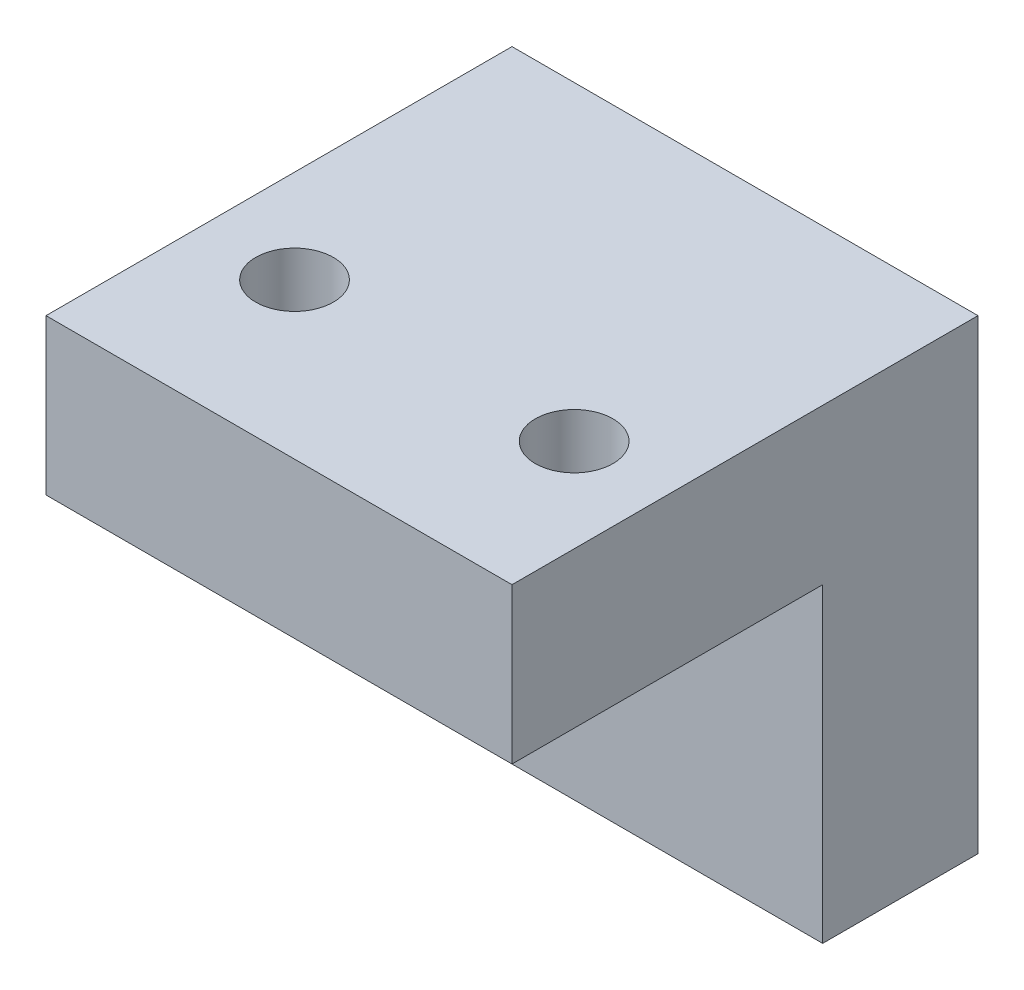
from build123d import *

# Parameters (mm, degrees)
SKETCH_1_W          = 15
SKETCH_1_H          = 5
EXTRUDE_1_DEPTH     = 10
SKETCH_2_W          = 15
SKETCH_2_H          = 15
EXTRUDE_2_DEPTH     = 5
SKETCH_3_R          = 1.25
CUT_EXTRUDE_1_DEPTH = 24.452078799
SKETCH_4_R          = 1.25
CUT_EXTRUDE_2_DEPTH = 5


with BuildPart() as part:
    # 草图1 → 凸台-拉伸1 (new body)
    with BuildSketch(Plane(origin=(0, 0, 0), x_dir=(1, 0, 0), z_dir=(0, 1, 0))):
        with Locations((7.5, 2.5)):
            Rectangle(SKETCH_1_W, SKETCH_1_H)
    extrude(amount=EXTRUDE_1_DEPTH)

    # 草图2 → 凸台-拉伸2 (add)
    with BuildSketch(Plane(origin=(0, 10, 0), x_dir=(1, 0, 0), z_dir=(0, 1, 0))):
        with Locations((7.5, -2.5)):
            Rectangle(SKETCH_2_W, SKETCH_2_H)
    extrude(amount=EXTRUDE_2_DEPTH)

    # 草图3 → 切除-拉伸1 (cut, through all)
    with BuildSketch(Plane.XY):
        with Locations((7.5, 5)):
            Circle(SKETCH_3_R)
    extrude(amount=-CUT_EXTRUDE_1_DEPTH, mode=Mode.SUBTRACT)

    # 草图4 → 切除-拉伸2 (cut)
    with BuildSketch(Plane(origin=(0, 15, 0), x_dir=(1, 0, 0), z_dir=(0, 1, 0))):
        with Locations(Location((3, -5, 0), (0, 0, 270))):
            Circle(SKETCH_4_R)
        with Locations(Location((12, -5, 0), (0, 0, 270))):
            Circle(SKETCH_4_R)
    extrude(amount=-CUT_EXTRUDE_2_DEPTH, mode=Mode.SUBTRACT)


solid = part.part
